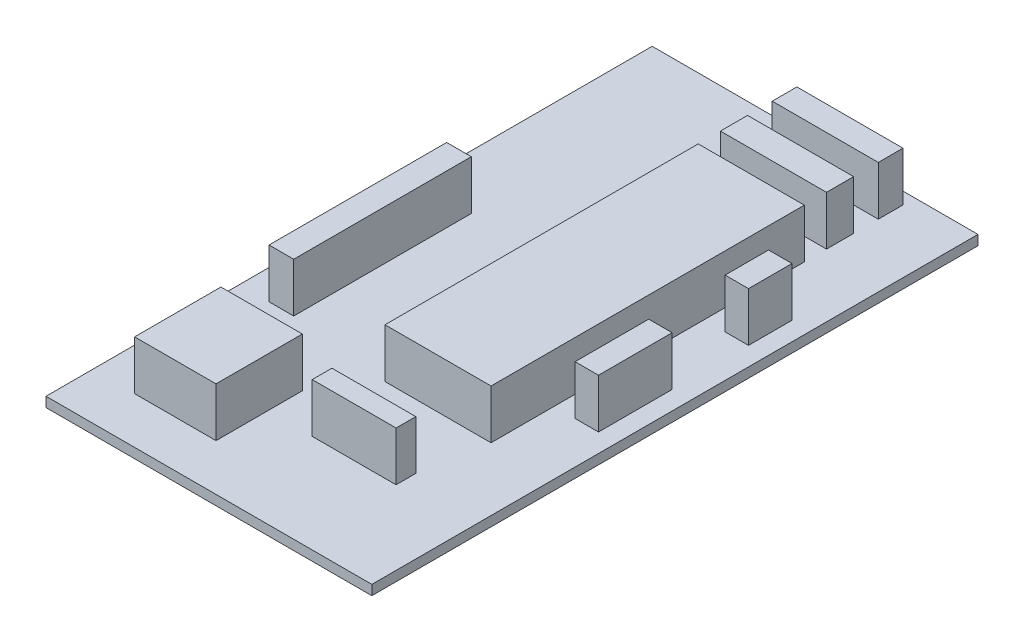
from build123d import *

# Parameters (mm, degrees)
CROQUIS2_W              = 53
CROQUIS2_H              = 98.6
SALIENTE_EXTRUIR1_DEPTH = 1.6
CROQUIS3_W              = 17.252718504
CROQUIS3_H              = 50.95570349
CROQUIS3_W_2            = 13.240458387
CROQUIS3_H_2            = 14.042910411
CROQUIS3_W_3            = 4.012260117
CROQUIS3_H_3            = 28.888272845
CROQUIS3_H_4            = 4.012260117
CROQUIS3_H_5            = 4.413486129
CROQUIS3_W_4            = 3.809203095
CROQUIS3_H_6            = 7.067484179
CROQUIS3_H_7            = 11.981054517
CROQUIS3_W_5            = 13.641684399
CROQUIS3_H_8            = 3.209808094
SALIENTE_EXTRUIR2_DEPTH = 8


with BuildPart() as part:
    # Croquis2 → Saliente-Extruir1 (new body)
    with BuildSketch(Plane(origin=(0, 0, 0), x_dir=(1, 0, 0), z_dir=(0, 1, 0))):
        Rectangle(CROQUIS2_W, CROQUIS2_H)
    extrude(amount=SALIENTE_EXTRUIR1_DEPTH)

    # Croquis3 → Saliente-Extruir2 (add)
    with BuildSketch(Plane(origin=(0, 1.6, 0), x_dir=(1, 0, 0), z_dir=(0, 1, 0))):
        with Locations((7.623294223, 5.81777717)):
            Rectangle(CROQUIS3_W, CROQUIS3_H)
        with Locations((-13.039845382, -34.706050015)):
            Rectangle(CROQUIS3_W_2, CROQUIS3_H_2)
        with Locations((-19.660074575, -3.410421099)):
            Rectangle(CROQUIS3_W_3, CROQUIS3_H_3)
        with Locations((7.623294223, 45.338539326)):
            Rectangle(CROQUIS3_W, CROQUIS3_H_4)
        with Locations((7.623294223, 37.113406084)):
            Rectangle(CROQUIS3_W, CROQUIS3_H_5)
        with Locations((21.567120139, 18.533688555)):
            Rectangle(CROQUIS3_W_4, CROQUIS3_H_6)
        with Locations((21.567120139, -3.4104211)):
            Rectangle(CROQUIS3_W_4, CROQUIS3_H_7)
        with Locations((7.623294223, -31.696854927)):
            Rectangle(CROQUIS3_W_5, CROQUIS3_H_8)
    extrude(amount=SALIENTE_EXTRUIR2_DEPTH)


solid = part.part
